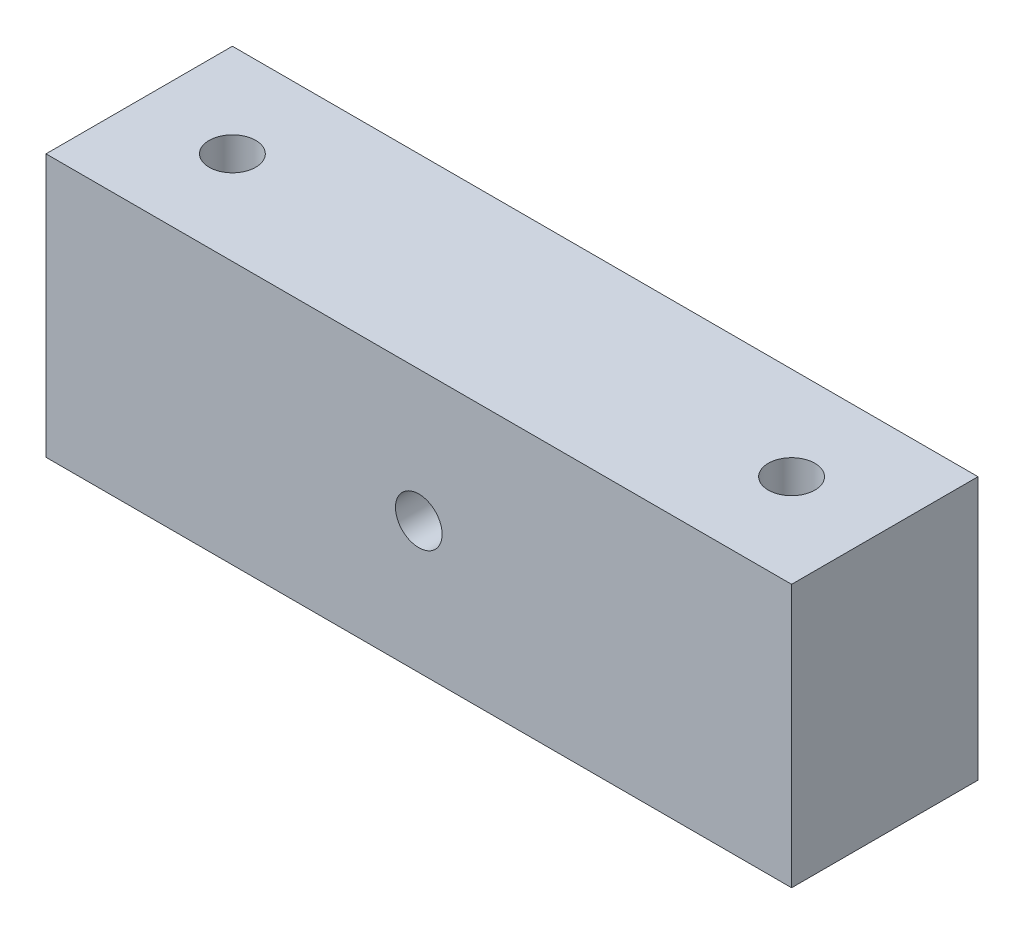
from build123d import *

# Parameters (mm, degrees)
SKETCH1_W             = 40
SKETCH1_H             = 10
BOSS_EXTRUDE1_DEPTH   = 14.1
M3X0_5_TAPPED_HOLE3_D = 2.5
M3X0_5_TAPPED_HOLE4_D = 2.5


with BuildPart() as part:
    # Sketch1 → Boss-Extrude1 (new body)
    with BuildSketch(Plane(origin=(0, 0, 0), x_dir=(1, 0, 0), z_dir=(0, 1, 0))):
        with Locations((20, 5)):
            Rectangle(SKETCH1_W, SKETCH1_H)
    extrude(amount=BOSS_EXTRUDE1_DEPTH)

    # M3x0.5 Tapped Hole3 (through all)
    with Locations(Plane(origin=(5, 14.1, -5), x_dir=(0, 0, 1), z_dir=(0, 1, 0))):
        with Locations((0, 0), (0, 30)):
            Hole(M3X0_5_TAPPED_HOLE3_D / 2)

    # M3x0.5 Tapped Hole4 (through all)
    with Locations(Plane(origin=(20, 7.05, -10), x_dir=(-1, 0, 0), z_dir=(0, 0, -1))):
        with Locations((0, 0)):
            Hole(M3X0_5_TAPPED_HOLE4_D / 2)


solid = part.part
